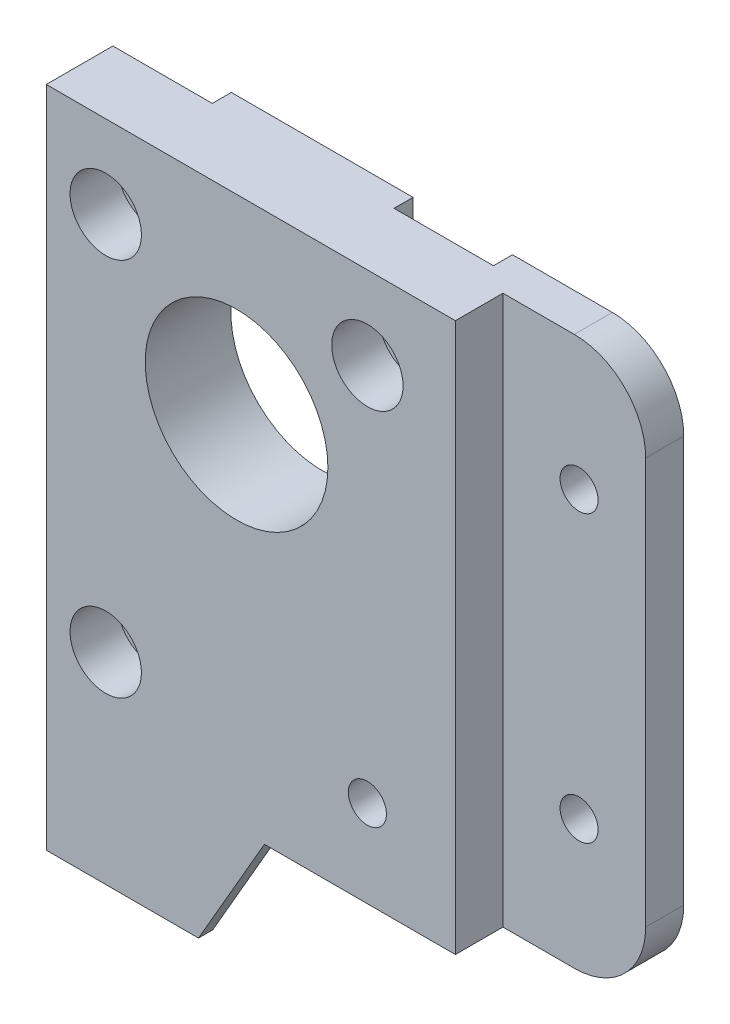
from build123d import *

# Parameters (mm, degrees)
SKETCH1_R           = 9.6
SKETCH1_R_2         = 4.2
BOSS_EXTRUDE1_DEPTH = 2
SKETCH4_W           = 58
SKETCH4_H           = 57.7
SKETCH4_R           = 2
SKETCH4_R_2         = 9.6
BOSS_EXTRUDE3_DEPTH = 2
SKETCH5_R           = 2
CUT_EXTRUDE1_DEPTH  = 4
SKETCH6_W           = 43
SKETCH6_H           = 57.7
SKETCH6_R           = 3.75
SKETCH6_R_2         = 9.6
SKETCH6_R_3         = 2
BOSS_EXTRUDE4_DEPTH = 5
CUT_EXTRUDE2_DEPTH  = 48.972101267
BOSS_EXTRUDE5_DEPTH = 6
BOSS_EXTRUDE6_DEPTH = 1.5


with BuildPart() as part:
    # Sketch1 → Boss-Extrude1 (new body)
    with BuildSketch(Plane.XY):
        with BuildLine():
            Line((38, 28.85), (20, 28.85))
            Line((20, 28.85), (20, 21.79369023))
            Line((20, 21.79369023), (17.201699017, 17.757141063))
            ThreePointArc((17.201699017, 17.757141063), (12.496432266, 16.141438171), (9.55, 20.15))
            Line((9.55, 20.15), (9.55, 28.85))
            Line((9.55, 28.85), (-9.55, 28.85))
            Line((-9.55, 28.85), (-9.55, 20.15))
            ThreePointArc((-9.55, 20.15), (-12.496432266, 16.141438171), (-17.201699017, 17.757141063))
            Line((-17.201699017, 17.757141063), (-20, 21.79369023))
            Line((-20, 21.79369023), (-20, -16.371914064))
            Line((-20, -16.371914064), (-16.312, -16.371914064))
            Line((-16.312, -16.371914064), (-12.349992933, -13.321914064))
            ThreePointArc((-12.349992933, -13.321914064), (-6.459906996, -14.088), (-7.225992933, -19.978085936))
            Line((-7.225992933, -19.978085936), (-11.188, -23.028085936))
            ThreePointArc((-11.188, -23.028085936), (-12.396848296, -23.676050863), (-13.75, -23.9))
            Line((-13.75, -23.9), (-20, -23.9))
            Line((-20, -23.9), (-20, -28.85))
            Line((-20, -28.85), (9.55, -28.85))
            Line((9.55, -28.85), (9.55, -19.7))
            ThreePointArc((9.55, -19.7), (12.496432266, -15.691438171), (17.201699017, -17.307141063))
            Line((17.201699017, -17.307141063), (20, -21.34369023))
            Line((20, -21.34369023), (20, -28.85))
            Line((20, -28.85), (38, -28.85))
            Line((38, -28.85), (38, 28.85))
        make_face()
        with Locations((0, 8.8)):
            Circle(SKETCH1_R, mode=Mode.SUBTRACT)
        with Locations((-5.725, -6.1)):
            Circle(SKETCH1_R_2, mode=Mode.SUBTRACT)
        with Locations((5.725, -6.1)):
            Circle(SKETCH1_R_2, mode=Mode.SUBTRACT)
    extrude(amount=BOSS_EXTRUDE1_DEPTH)

    # Sketch4 → Boss-Extrude3 (add)
    with BuildSketch(Plane.XY.offset(2)):
        with Locations((9, 0)):
            Rectangle(SKETCH4_W, SKETCH4_H)
        with Locations((13.75, -19.7)):
            Circle(SKETCH4_R, mode=Mode.SUBTRACT)
        with Locations((-13.75, 20.15)):
            Circle(SKETCH4_R, mode=Mode.SUBTRACT)
        with Locations((13.75, 20.15)):
            Circle(SKETCH4_R, mode=Mode.SUBTRACT)
        with Locations((-13.75, -19.7)):
            Circle(SKETCH4_R, mode=Mode.SUBTRACT)
        with Locations((0, 8.8)):
            Circle(SKETCH4_R_2, mode=Mode.SUBTRACT)
    extrude(amount=BOSS_EXTRUDE3_DEPTH)

    # Sketch5 → Cut-Extrude1 (cut)
    with BuildSketch(Plane.XY.offset(4)):
        with Locations((31, 15)):
            Circle(SKETCH5_R)
        with Locations((31, -15)):
            Circle(SKETCH5_R)
    extrude(amount=-CUT_EXTRUDE1_DEPTH, mode=Mode.SUBTRACT)

    # Sketch6 → Boss-Extrude4 (add)
    with BuildSketch(Plane.XY.offset(4)):
        with Locations((1.5, 0)):
            Rectangle(SKETCH6_W, SKETCH6_H)
        with Locations((-13.75, -19.7)):
            Circle(SKETCH6_R, mode=Mode.SUBTRACT)
        with Locations((0, 8.8)):
            Circle(SKETCH6_R_2, mode=Mode.SUBTRACT)
        with Locations((-13.75, 20.15)):
            Circle(SKETCH6_R, mode=Mode.SUBTRACT)
        with Locations((13.75, 20.15)):
            Circle(SKETCH6_R, mode=Mode.SUBTRACT)
        with Locations((13.75, -19.7)):
            Circle(SKETCH6_R_3, mode=Mode.SUBTRACT)
    extrude(amount=BOSS_EXTRUDE4_DEPTH)

    # Sketch7 → Cut-Extrude2 (cut, through all)
    with BuildSketch(Plane.XY.offset(4)):
        with BuildLine():
            Line((30.5, 28.85), (38, 28.85))
            Line((38, 28.85), (38, 21.35))
            ThreePointArc((38, 21.35), (35.803300859, 26.653300859), (30.5, 28.85))
        make_face()
        with BuildLine():
            Line((38, -28.85), (38, -21.35))
            ThreePointArc((38, -21.35), (35.803300859, -26.653300859), (30.5, -28.85))
            Line((30.5, -28.85), (38, -28.85))
        make_face()
    extrude(amount=-CUT_EXTRUDE2_DEPTH, mode=Mode.SUBTRACT)

    # Sketch9 → Boss-Extrude5 (add)
    with BuildSketch(Plane.ZY.offset(20)):
        Polygon((9, -28.85), (9, -40.85), (0, -40.85), (0, -35.15), (3, -35.15), (3, -28.85), align=None)
    extrude(amount=-BOSS_EXTRUDE5_DEPTH)

    # Sketch10 → Boss-Extrude6 (add)
    with BuildSketch(Plane.XY.offset(9)):
        Polygon((-14, -40.85), (-4, -40.85), (2.92820323, -28.85), (-14, -28.85), align=None)
    extrude(amount=-BOSS_EXTRUDE6_DEPTH)


solid = part.part
